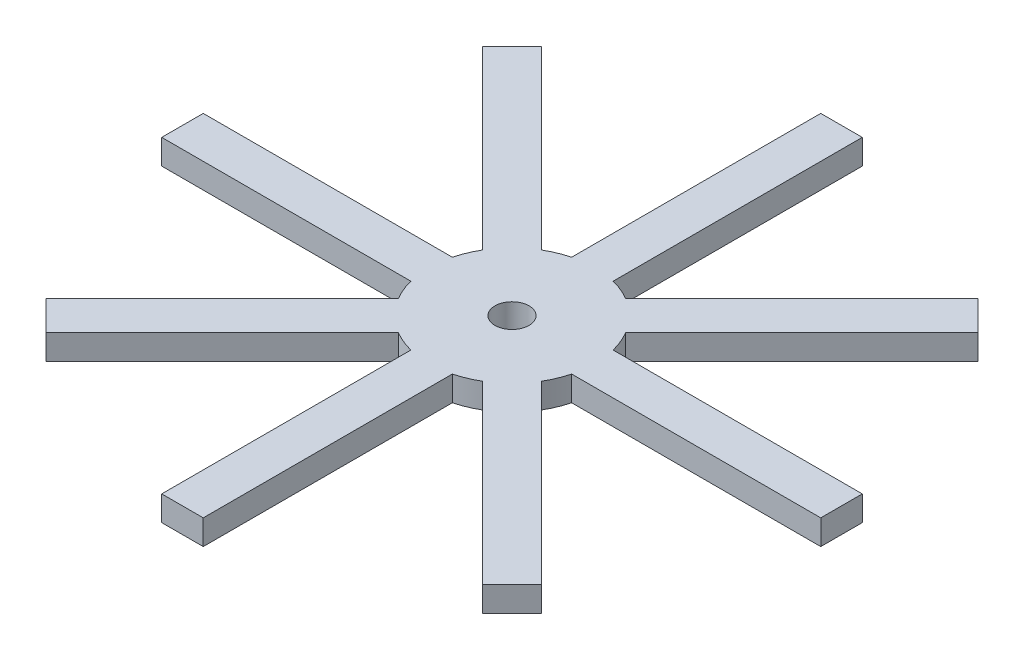
from build123d import *

# Parameters (mm, degrees)
ESBO_O1_R                = 20
ESBO_O1_R_2              = 4.1
RESSALTO_EXTRUS_O1_DEPTH = 6
ESBO_O2_W                = 10
ESBO_O2_H                = 60
ESBO_O2_W_2              = 60
ESBO_O2_H_2              = 10
RESSALTO_EXTRUS_O2_DEPTH = 6


with BuildPart() as part:
    # Esboço1 → Ressalto-extrusão1 (new body)
    with BuildSketch(Plane(origin=(0, 0, 0), x_dir=(1, 0, 0), z_dir=(0, 1, 0))):
        with Locations(Location((0, 0, 0), (0, 0, 270))):
            Circle(ESBO_O1_R)
        with Locations(Location((0, 0, 0), (0, 0, 270))):
            Circle(ESBO_O1_R_2, mode=Mode.SUBTRACT)
    extrude(amount=RESSALTO_EXTRUS_O1_DEPTH)

    # Esboço2 → Ressalto-extrusão2 (add)
    with BuildSketch(Plane(origin=(0, 6, 0), x_dir=(1, 0, 0), z_dir=(0, 1, 0))):
        Polygon((52.583936903, 59.655004715), (59.655004715, 52.583936903), (17.228597844, 10.157530032), (10.157530032, 17.228597844), align=None)
        with Locations((0, 49.364916731)):
            Rectangle(ESBO_O2_W, ESBO_O2_H)
        with Locations((49.364916731, 0)):
            Rectangle(ESBO_O2_W_2, ESBO_O2_H_2)
        Polygon((59.655004715, -52.583936903), (52.583936903, -59.655004715), (10.157530032, -17.228597844), (17.228597844, -10.157530032), align=None)
        with Locations((0, -49.364916731)):
            Rectangle(ESBO_O2_W, ESBO_O2_H)
        Polygon((-52.583936903, -59.655004715), (-59.655004715, -52.583936903), (-17.228597844, -10.157530032), (-10.157530032, -17.228597844), align=None)
        with Locations((-49.364916731, 0)):
            Rectangle(ESBO_O2_W_2, ESBO_O2_H_2)
        Polygon((-59.655004715, 52.583936903), (-52.583936903, 59.655004715), (-10.157530032, 17.228597844), (-17.228597844, 10.157530032), align=None)
    extrude(amount=-RESSALTO_EXTRUS_O2_DEPTH)


solid = part.part
